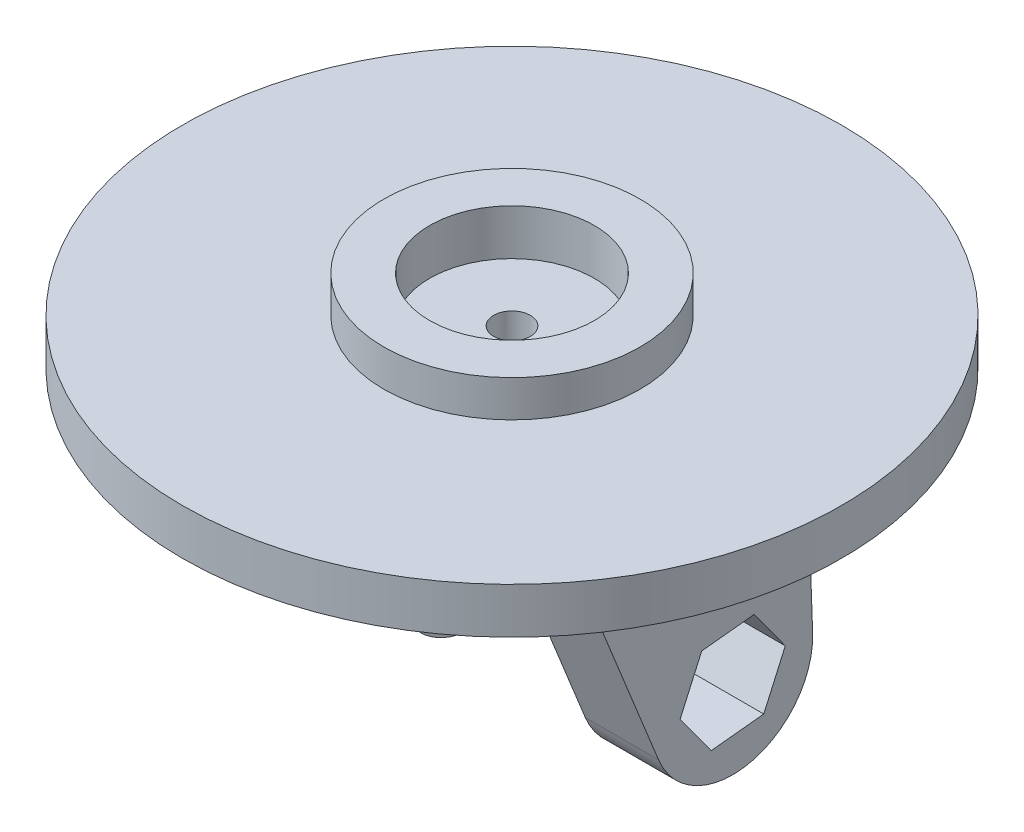
from build123d import *

# Parameters (mm, degrees)
SKETCH_1_R          = 7
EXTRUDE_1_DEPTH     = 4
SKETCH_2_R          = 7
SKETCH_2_R_2        = 4.5
EXTRUDE_2_DEPTH     = 2.5
SKETCH_3_R          = 1
CUT_EXTRUDE_1_DEPTH = 2.5
CUT_EXTRUDE_2_DEPTH = 2
SKETCH_5_R          = 18
SKETCH_5_R_2        = 7
EXTRUDE_3_DEPTH     = 2.5
EXTRUDE_4_DEPTH     = 2


with BuildPart() as part:
    # 草图1 → 凸台-拉伸1 (new body)
    with BuildSketch(Plane(origin=(0, 0, 0), x_dir=(1, 0, 0), z_dir=(0, 1, 0))):
        with Locations(Location((0, 0, 0), (0, 0, 270))):
            Circle(SKETCH_1_R)
    extrude(amount=EXTRUDE_1_DEPTH)

    # 草图2 → 凸台-拉伸2 (add)
    with BuildSketch(Plane(origin=(0, 4, 0), x_dir=(1, 0, 0), z_dir=(0, 1, 0))):
        with Locations(Location((0, 0, 0), (0, 0, 270))):
            Circle(SKETCH_2_R)
        with Locations(Location((0, 0, 0), (0, 0, 270))):
            Circle(SKETCH_2_R_2, mode=Mode.SUBTRACT)
    extrude(amount=EXTRUDE_2_DEPTH)

    # 草图3 → 切除-拉伸1 (cut)
    with BuildSketch(Plane(origin=(0, 4, 0), x_dir=(1, 0, 0), z_dir=(0, 1, 0))):
        with Locations(Location((0, 0, 0), (0, 0, 270))):
            Circle(SKETCH_3_R)
    extrude(amount=-CUT_EXTRUDE_1_DEPTH, mode=Mode.SUBTRACT)

    # 草图4 → 切除-拉伸2 (cut)
    with BuildSketch(Plane.XZ):
        Polygon((1.459083967, -2.490864772), (2.886694153, 0.018171396), (1.427610186, 2.509036167), (-1.459083967, 2.490864772), (-2.886694153, -0.018171396), (-1.427610186, -2.509036167), align=None)
    extrude(amount=-CUT_EXTRUDE_2_DEPTH, mode=Mode.SUBTRACT)

    # 草图5 → 凸台-拉伸3 (add)
    with BuildSketch(Plane(origin=(0, 2, 0), x_dir=(1, 0, 0), z_dir=(0, 1, 0))):
        with Locations(Location((0, 0, 0), (0, 0, 270))):
            Circle(SKETCH_5_R)
        with Locations(Location((0, 0, 0), (0, 0, 270))):
            Circle(SKETCH_5_R_2, mode=Mode.SUBTRACT)
    extrude(amount=EXTRUDE_3_DEPTH)

    # 草图6 → 凸台-拉伸4 (add, symmetric)
    with BuildSketch(Plane(origin=(7, 0, 0), x_dir=(0, 0, -1), z_dir=(1, 0, 0))):
        with BuildLine():
            Line((-6.459228818, 2), (-0.994639994, -11.532205447))
            ThreePointArc((-0.994639994, -11.532205447), (3.965427991, -14.168883056), (7.420905758, -9.740111597))
            Line((7.420905758, -9.740111597), (7, 2))
            Line((7, 2), (-6.459228818, 2))
        make_face()
        Polygon((4.232968046, -7.260851368), (1.361669462, -7.559142793), (0.184348122, -10.194906021), (1.878325366, -12.532377824), (4.74962395, -12.234086399), (5.92694529, -9.598323171), align=None, mode=Mode.SUBTRACT)
    extrude_4 = extrude(amount=EXTRUDE_4_DEPTH, both=True)

    # 镜向1: 凸台-拉伸4 across plane
    add(extrude_4.mirror(Plane(origin=(0, 0, 0), x_dir=(0, 0, 1), z_dir=(1, 0, 0))))


solid = part.part
